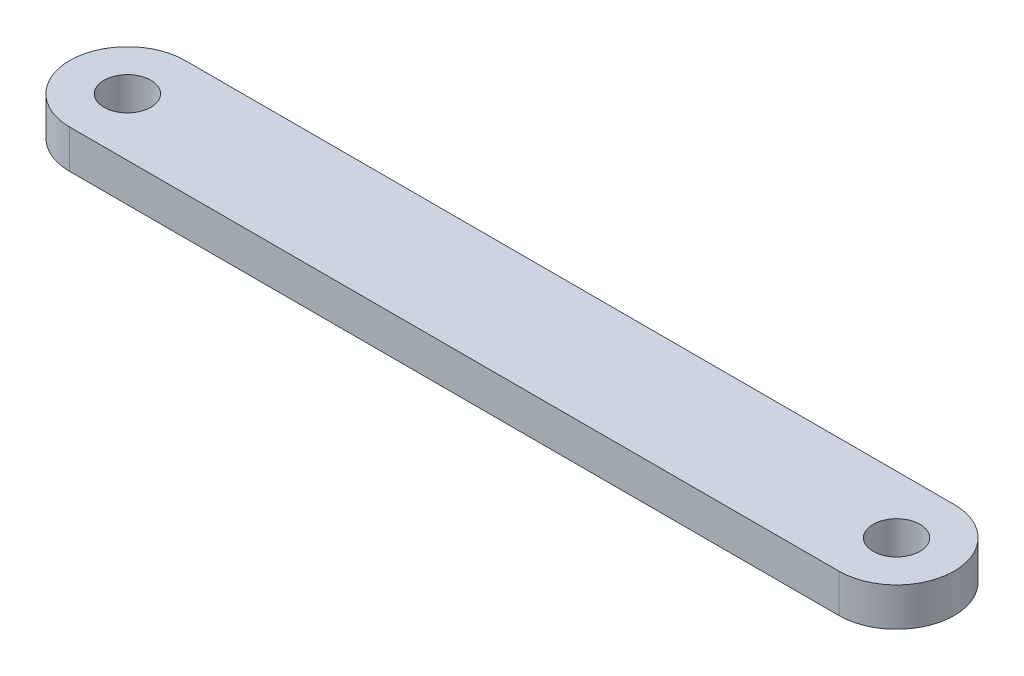
from build123d import *

# Parameters (mm, degrees)
SKETCH1_R           = 1.55
BOSS_EXTRUDE1_DEPTH = 2.54


with BuildPart() as part:
    # Sketch1 → Boss-Extrude1 (new body)
    with BuildSketch(Plane(origin=(0, 0, 0), x_dir=(1, 0, 0), z_dir=(0, 1, 0))):
        with BuildLine():
            Line((0, -3.81), (-50.8, -3.81))
            ThreePointArc((-50.8, -3.81), (-54.61, 0), (-50.8, 3.81))
            Line((-50.8, 3.81), (0, 3.81))
            ThreePointArc((0, 3.81), (3.81, 0), (0, -3.81))
        make_face()
        with Locations(Location((-50.8, 0, 0), (0, 0, 270))):
            Circle(SKETCH1_R, mode=Mode.SUBTRACT)
        with Locations(Location((0, 0, 0), (0, 0, 270))):
            Circle(SKETCH1_R, mode=Mode.SUBTRACT)
    extrude(amount=BOSS_EXTRUDE1_DEPTH)


solid = part.part
